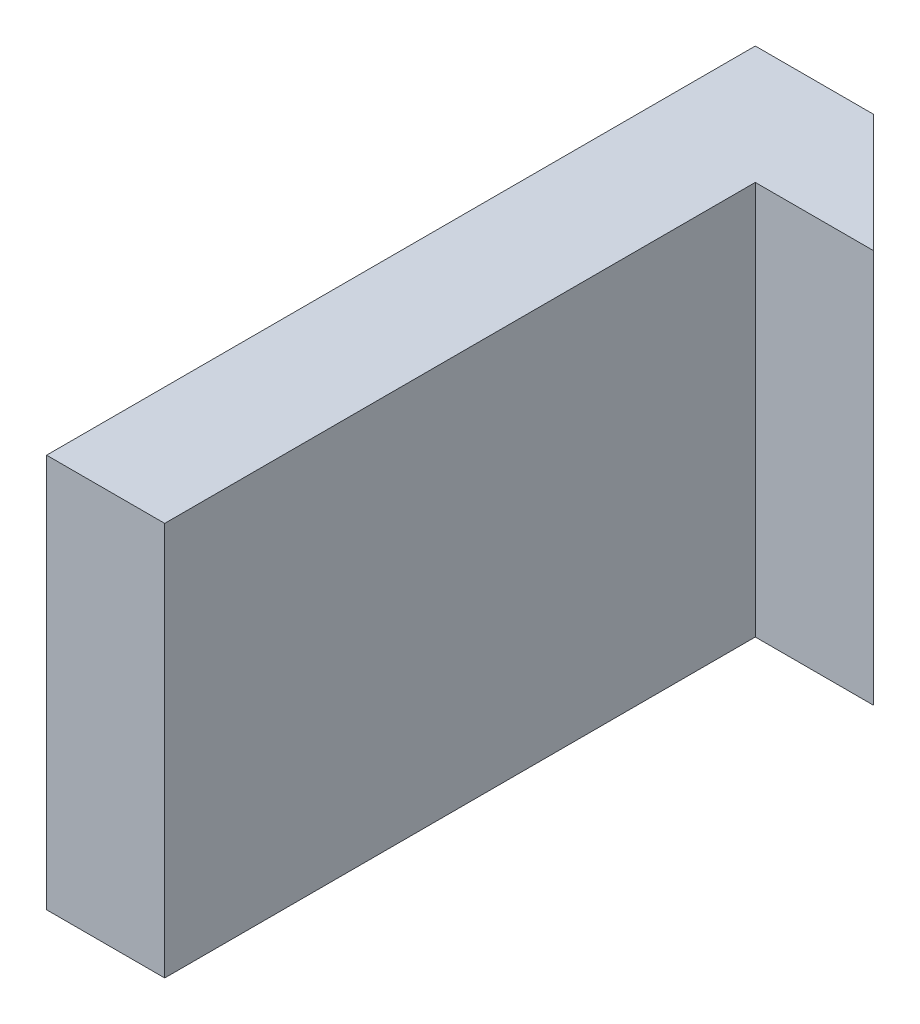
from build123d import *

# Parameters (mm, degrees)
SKETCH1_W           = 1.5
SKETCH1_H           = 3
BOSS_EXTRUDE1_DEPTH = 5


with BuildPart() as part:
    # Sketch1 → Boss-Extrude1 (new body)
    with BuildSketch(Plane(origin=(0, 0, 0), x_dir=(1, 0, 0), z_dir=(0, 1, 0))):
        Rectangle(SKETCH1_W, SKETCH1_H)
        Polygon((0.75, 6), (0.75, 1.5), (-0.75, 1.5), (-0.75, 7.5), (0.75, 7.5), (2.25, 6), align=None)
    extrude(amount=BOSS_EXTRUDE1_DEPTH)


solid = part.part
